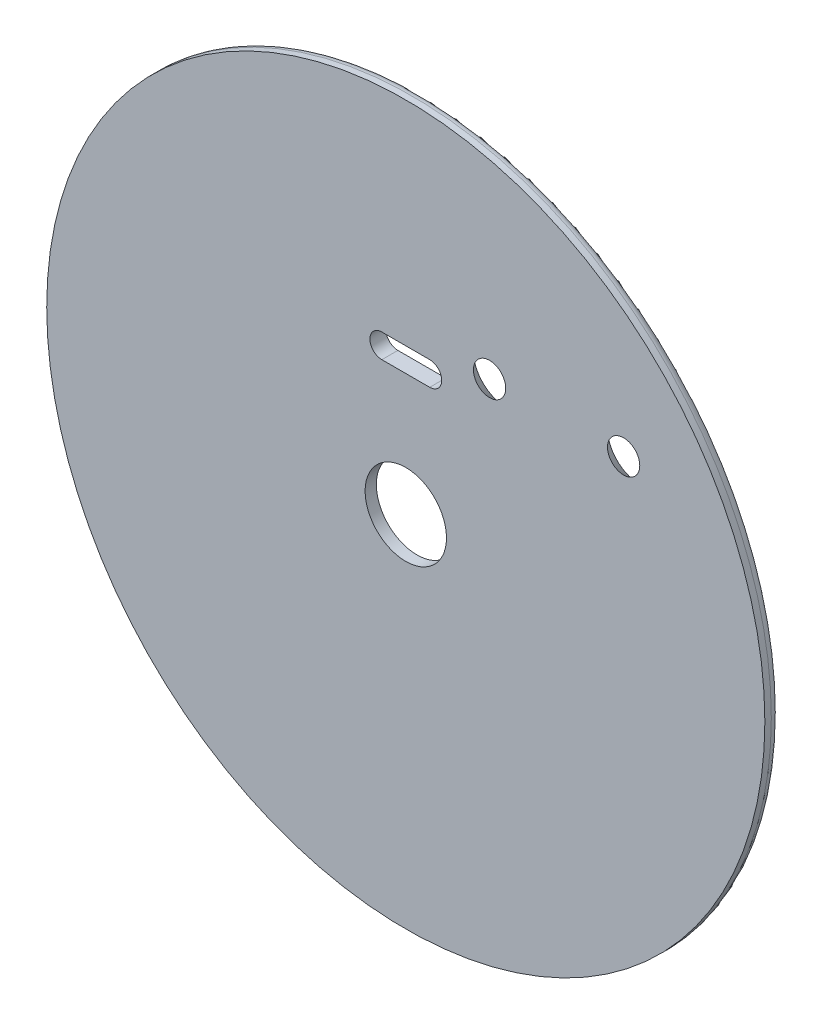
from build123d import *

# Parameters (mm, degrees)
ESBO_O1_R             = 75
ESBO_O1_R_2           = 8.5
EXTRUS_O1_DEPTH       = 3.35
ESBO_O2_R             = 24.25
CORTE_EXTRUS_O1_DEPTH = 1
CORTE_EXTRUS_O3_DEPTH = 10
LPATTERN3_COUNT       = 2
LPATTERN3_PITCH       = 28
FILETE1_R             = 2


with BuildPart() as part:
    # Esboço1 → Extrusão1 (new body)
    with BuildSketch(Plane.XY):
        Circle(ESBO_O1_R)
        Circle(ESBO_O1_R_2, mode=Mode.SUBTRACT)
    extrude(amount=EXTRUS_O1_DEPTH)

    # Esboço2 → Corte-extrusão1 (cut)
    with BuildSketch(Plane(origin=(0, 0, 0), x_dir=(-1, 0, 0), z_dir=(0, 0, -1))):
        Circle(ESBO_O2_R)
    extrude(amount=-CORTE_EXTRUS_O1_DEPTH, mode=Mode.SUBTRACT)

    # Esboço6 → Corte-extrusão3 (cut)
    with BuildSketch(Plane(origin=(0, 0, 0), x_dir=(-1, 0, 0), z_dir=(0, 0, -1))):
        with BuildLine():
            Line((-5, 25.5), (5, 25.5))
            ThreePointArc((5, 25.5), (7.5, 28), (5, 30.5))
            Line((5, 30.5), (-5, 30.5))
            ThreePointArc((-5, 30.5), (-7.5, 28), (-5, 25.5))
        make_face()
    extrude(amount=-CORTE_EXTRUS_O3_DEPTH, mode=Mode.SUBTRACT)

    # Esboço8 → Escareado para SFHCS M63 (revolve, cut)
    with BuildSketch(Plane(origin=(17.5, 33.25, 0), x_dir=(0, 1, 0), z_dir=(1, 0, 0))):
        Polygon((0, 0), (0, 3.35), (3.3, 3.35), (3.3, 3.42), (6.72, 0), align=None)
    escareado_para_sfhcs_m63 = revolve(axis=Axis((17.5, 33.25, -6.35), (0, 0, 1)), mode=Mode.SUBTRACT)

    # LPattern3: Escareado para SFHCS M63 ×2
    with Locations(*[(i * LPATTERN3_PITCH, 0, 0) for i in range(1, LPATTERN3_COUNT)]):
        add(escareado_para_sfhcs_m63, mode=Mode.SUBTRACT)

    # Filete1
    filete1_edges = [part.edges().sort_by_distance(p)[0] for p in [
        (-75, 0, 0),
    ]]
    fillet(filete1_edges, radius=FILETE1_R)


solid = part.part
